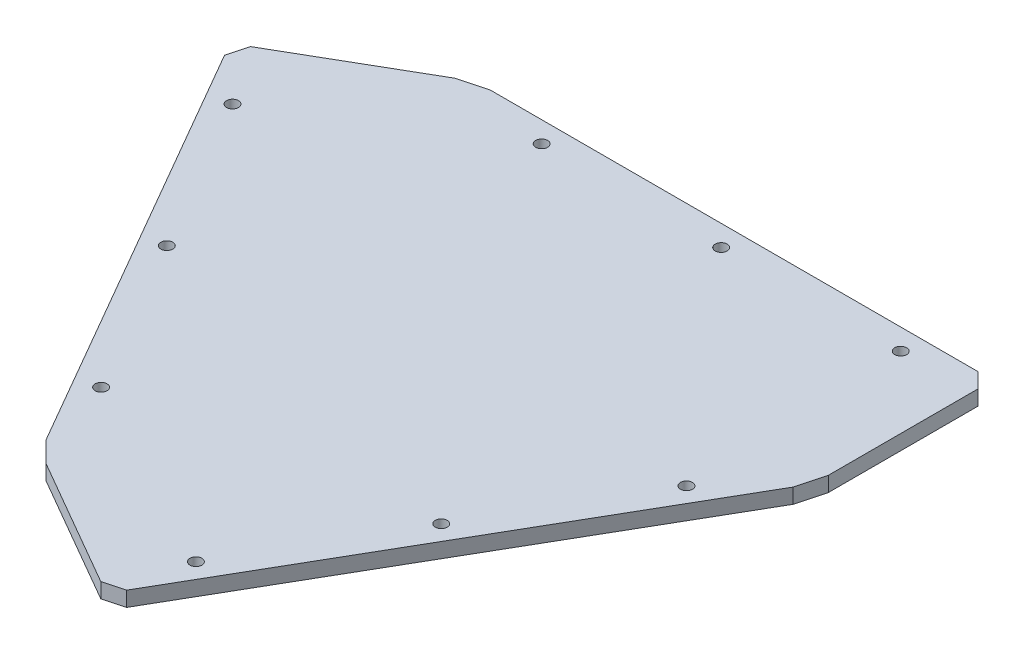
from build123d import *

# Parameters (mm, degrees)
EXTRUSION1_DEPTH         = 5
ENL_V_MAT_EXTRU_14_REACH = 176.146
ESQUISSE8_R              = 2


with BuildPart() as part:
    # Esquisse1 → Extrusion1 (new body)
    with BuildSketch(Plane(origin=(0, 0, 0), x_dir=(1, 0, 0), z_dir=(0, 1, 0))):
        Polygon((-64.179491924, 79.940798285), (98.820508076, 79.940798285), (103.820508076, 74.940798285), (103.820508076, 24.940798285), (101.320508076, 15.610671266), (19.820508076, -125.551469551), (12.990381057, -127.38159657), (-30.310889132, -102.38159657), (-37.141016151, -95.551469551), (-118.641016151, 45.610671266), (-116.810889132, 52.440798285), (-73.509618943, 77.440798285), align=None)
    extrude(amount=EXTRUSION1_DEPTH)

    # Esquisse8 → Enlèv. mat.-Extru.14 (cut, up to next)
    with BuildSketch(Plane(origin=(0, 5, 0), x_dir=(1, 0, 0), z_dir=(0, 1, 0)), mode=Mode.PRIVATE) as enl_v_mat_extru_14_sk1:
        with Locations(Location((-103.168584287, 32.81163316, 0), (0, 0, 270))):
            Circle(ESQUISSE8_R)
    enl_v_mat_extru_14_tool1 = extrude(enl_v_mat_extru_14_sk1.sketch, amount=-ENL_V_MAT_EXTRU_14_REACH, mode=Mode.PRIVATE) & part.part
    # Esquisse8 → Enlèv. mat.-Extru.14 (cut, up to next)
    with BuildSketch(Plane(origin=(0, 5, 0), x_dir=(1, 0, 0), z_dir=(0, 1, 0)), mode=Mode.PRIVATE) as enl_v_mat_extru_14_sk2:
        with Locations(Location((80, 72.940798285, 0), (0, 0, 270))):
            Circle(ESQUISSE8_R)
    enl_v_mat_extru_14_tool2 = extrude(enl_v_mat_extru_14_sk2.sketch, amount=-ENL_V_MAT_EXTRU_14_REACH, mode=Mode.PRIVATE) & part.part
    # Esquisse8 → Enlèv. mat.-Extru.14 (cut, up to next)
    with BuildSketch(Plane(origin=(0, 5, 0), x_dir=(1, 0, 0), z_dir=(0, 1, 0)), mode=Mode.PRIVATE) as enl_v_mat_extru_14_sk3:
        with Locations(Location((20, 72.940798285, 0), (0, 0, 270))):
            Circle(ESQUISSE8_R)
    enl_v_mat_extru_14_tool3 = extrude(enl_v_mat_extru_14_sk3.sketch, amount=-ENL_V_MAT_EXTRU_14_REACH, mode=Mode.PRIVATE) & part.part
    # Esquisse8 → Enlèv. mat.-Extru.14 (cut, up to next)
    with BuildSketch(Plane(origin=(0, 5, 0), x_dir=(1, 0, 0), z_dir=(0, 1, 0)), mode=Mode.PRIVATE) as enl_v_mat_extru_14_sk4:
        with Locations(Location((-73.168584287, -19.149891067, 0), (0, 0, 270))):
            Circle(ESQUISSE8_R)
    enl_v_mat_extru_14_tool4 = extrude(enl_v_mat_extru_14_sk4.sketch, amount=-ENL_V_MAT_EXTRU_14_REACH, mode=Mode.PRIVATE) & part.part
    # Esquisse8 → Enlèv. mat.-Extru.14 (cut, up to next)
    with BuildSketch(Plane(origin=(0, 5, 0), x_dir=(1, 0, 0), z_dir=(0, 1, 0)), mode=Mode.PRIVATE) as enl_v_mat_extru_14_sk5:
        with Locations(Location((-43.168584287, -71.111415294, 0), (0, 0, 270))):
            Circle(ESQUISSE8_R)
    enl_v_mat_extru_14_tool5 = extrude(enl_v_mat_extru_14_sk5.sketch, amount=-ENL_V_MAT_EXTRU_14_REACH, mode=Mode.PRIVATE) & part.part
    # Esquisse8 → Enlèv. mat.-Extru.14 (cut, up to next)
    with BuildSketch(Plane(origin=(0, 5, 0), x_dir=(1, 0, 0), z_dir=(0, 1, 0)), mode=Mode.PRIVATE) as enl_v_mat_extru_14_sk6:
        with Locations(Location((-40, 72.940798285, 0), (0, 0, 270))):
            Circle(ESQUISSE8_R)
    enl_v_mat_extru_14_tool6 = extrude(enl_v_mat_extru_14_sk6.sketch, amount=-ENL_V_MAT_EXTRU_14_REACH, mode=Mode.PRIVATE) & part.part
    # Esquisse8 → Enlèv. mat.-Extru.14 (cut, up to next)
    with BuildSketch(Plane(origin=(0, 5, 0), x_dir=(1, 0, 0), z_dir=(0, 1, 0)), mode=Mode.PRIVATE) as enl_v_mat_extru_14_sk7:
        with Locations(Location((23.168584287, -105.752431445, 0), (0, 0, 270))):
            Circle(ESQUISSE8_R)
    enl_v_mat_extru_14_tool7 = extrude(enl_v_mat_extru_14_sk7.sketch, amount=-ENL_V_MAT_EXTRU_14_REACH, mode=Mode.PRIVATE) & part.part
    # Esquisse8 → Enlèv. mat.-Extru.14 (cut, up to next)
    with BuildSketch(Plane(origin=(0, 5, 0), x_dir=(1, 0, 0), z_dir=(0, 1, 0)), mode=Mode.PRIVATE) as enl_v_mat_extru_14_sk8:
        with Locations(Location((53.168584287, -53.790907218, 0), (0, 0, 270))):
            Circle(ESQUISSE8_R)
    enl_v_mat_extru_14_tool8 = extrude(enl_v_mat_extru_14_sk8.sketch, amount=-ENL_V_MAT_EXTRU_14_REACH, mode=Mode.PRIVATE) & part.part
    # Esquisse8 → Enlèv. mat.-Extru.14 (cut, up to next)
    with BuildSketch(Plane(origin=(0, 5, 0), x_dir=(1, 0, 0), z_dir=(0, 1, 0)), mode=Mode.PRIVATE) as enl_v_mat_extru_14_sk9:
        with Locations(Location((83.168584287, -1.829382991, 0), (0, 0, 270))):
            Circle(ESQUISSE8_R)
    enl_v_mat_extru_14_tool9 = extrude(enl_v_mat_extru_14_sk9.sketch, amount=-ENL_V_MAT_EXTRU_14_REACH, mode=Mode.PRIVATE) & part.part
    add(enl_v_mat_extru_14_tool1.solids().sort_by_distance((-103.168584, 5, -32.811633))[0], mode=Mode.SUBTRACT)
    add(enl_v_mat_extru_14_tool2.solids().sort_by_distance((80, 5, -72.940798))[0], mode=Mode.SUBTRACT)
    add(enl_v_mat_extru_14_tool3.solids().sort_by_distance((20, 5, -72.940798))[0], mode=Mode.SUBTRACT)
    add(enl_v_mat_extru_14_tool4.solids().sort_by_distance((-73.168584, 5, 19.149891))[0], mode=Mode.SUBTRACT)
    add(enl_v_mat_extru_14_tool5.solids().sort_by_distance((-43.168584, 5, 71.111415))[0], mode=Mode.SUBTRACT)
    add(enl_v_mat_extru_14_tool6.solids().sort_by_distance((-40, 5, -72.940798))[0], mode=Mode.SUBTRACT)
    add(enl_v_mat_extru_14_tool7.solids().sort_by_distance((23.168584, 5, 105.752431))[0], mode=Mode.SUBTRACT)
    add(enl_v_mat_extru_14_tool8.solids().sort_by_distance((53.168584, 5, 53.790907))[0], mode=Mode.SUBTRACT)
    add(enl_v_mat_extru_14_tool9.solids().sort_by_distance((83.168584, 5, 1.829383))[0], mode=Mode.SUBTRACT)


solid = part.part
